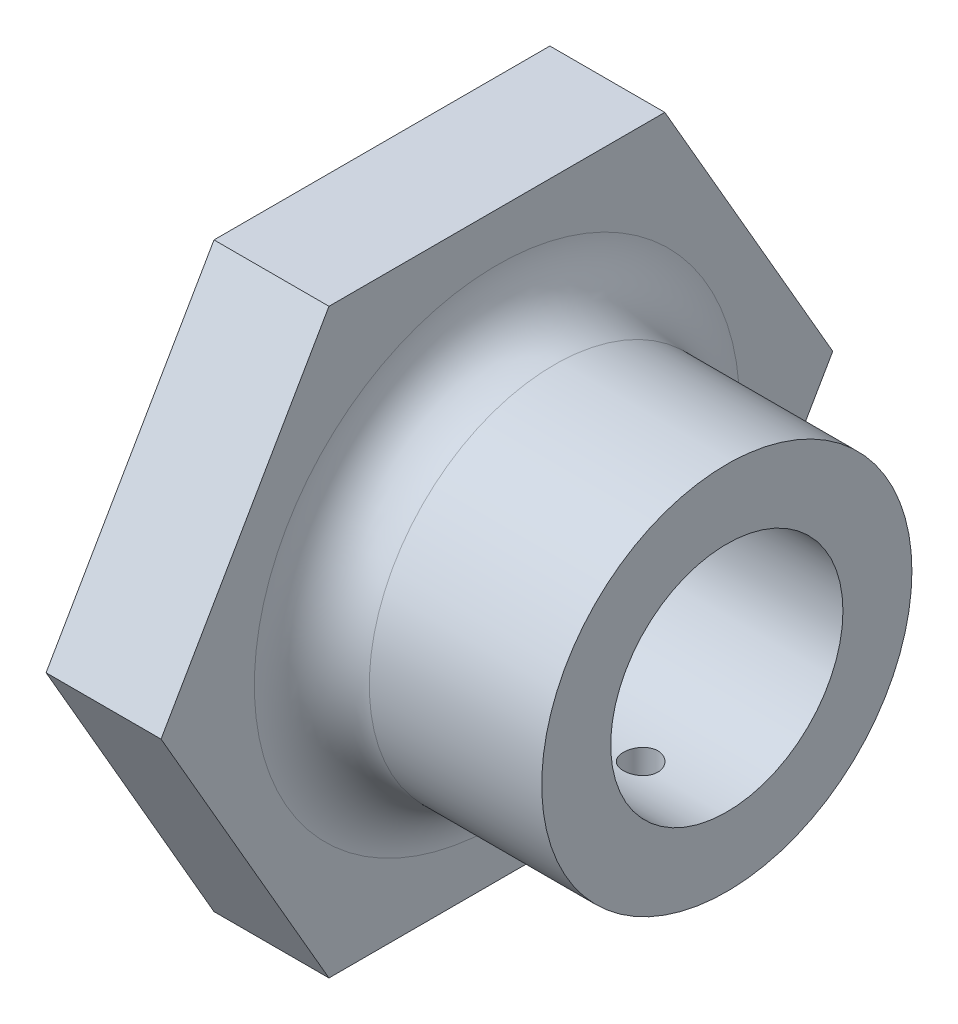
from build123d import *

# Parameters (mm, degrees)
SKETCH1_R           = 10.1
BOSS_EXTRUDE1_DEPTH = 10
SKETCH2_R           = 16.1
SKETCH2_R_2         = 10.1
BOSS_EXTRUDE2_DEPTH = 20
FILLET1_R           = 5
CUT_EXTRUDE1_DEPTH  = 20


with BuildPart() as part:
    # Sketch1 → Boss-Extrude1 (new body)
    with BuildSketch(Plane(origin=(0, 0, 0), x_dir=(0, 0, -1), z_dir=(1, 0, 0))):
        Polygon((14.60696181, 25.3), (-14.60696181, 25.3), (-29.213923621, 0), (-14.60696181, -25.3), (14.60696181, -25.3), (29.213923621, 0), align=None)
        Circle(SKETCH1_R, mode=Mode.SUBTRACT)
    extrude(amount=BOSS_EXTRUDE1_DEPTH)

    # Sketch2 → Boss-Extrude2 (add)
    with BuildSketch(Plane(origin=(10, 0, 0), x_dir=(0, 0, -1), z_dir=(1, 0, 0))):
        Circle(SKETCH2_R)
        Circle(SKETCH2_R_2, mode=Mode.SUBTRACT)
    extrude(amount=BOSS_EXTRUDE2_DEPTH)

    # Fillet1
    fillet1_edges = [part.edges().sort_by_distance(p)[0] for p in [
        (10, 0, 16.1),
    ]]
    fillet(fillet1_edges, radius=FILLET1_R)

    # Sketch3 → Cut-Extrude1 (cut)
    with BuildSketch(Plane(origin=(0, 0, 0), x_dir=(1, 0, 0), z_dir=(0, 1, 0))):
        with BuildLine():
            ThreePointArc((21, 0), (22.5, -1.5), (24, 0))
            Line((24, 0), (21, 0))
        make_face()
        with BuildLine():
            Line((21, 0), (24, 0))
            ThreePointArc((24, 0), (22.5, 1.5), (21, 0))
        make_face()
    extrude(amount=-CUT_EXTRUDE1_DEPTH, mode=Mode.SUBTRACT)


solid = part.part
